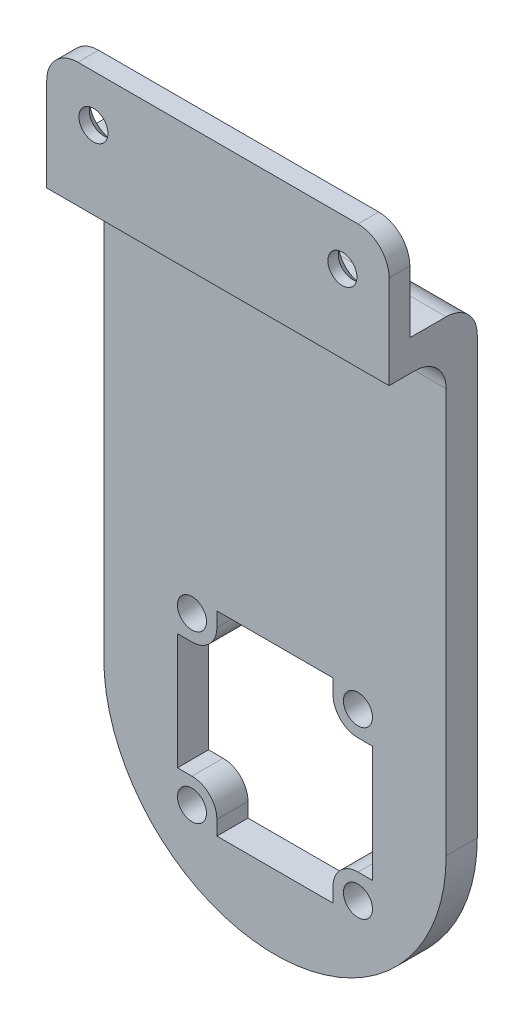
from build123d import *

# Parameters (mm, degrees)
SKETCH1_R           = 16.5
SKETCH1_R_2         = 2.4
SKETCH1_R_3         = 1.4
BOSS_EXTRUDE1_DEPTH = 3
BOSS_EXTRUDE2_START = -3
SKETCH3_R           = 1.4
BOSS_EXTRUDE2_DEPTH = 3
SKETCH4_W           = 33
SKETCH4_H           = 12
SKETCH4_R           = 1.4
BOSS_EXTRUDE3_DEPTH = 5.5
SKETCH5_W           = 33
SKETCH5_H           = 9
CUT_EXTRUDE1_DEPTH  = 6.5
FILLET1_R           = 3
CHAMFER1_SIZE       = 1


with BuildPart() as part:
    # Sketch1 → Boss-Extrude1 (new body)
    # profile 1 of 5: a face of its own
    with BuildSketch(Plane.XY):
        with Locations((3.7111495, -7.618539739)):
            Circle(SKETCH1_R)
        with BuildLine():
            ThreePointArc((-4.2888505, -2.018539739), (-5.985906775, 2.078516536), (-1.8888505, 0.381460261))
            Line((-1.8888505, 0.381460261), (-1.8888505, 1.781460261))
            Line((-1.8888505, 1.781460261), (9.3111495, 1.781460261))
            Line((9.3111495, 1.781460261), (9.3111495, 0.381460261))
            ThreePointArc((9.3111495, 0.381460261), (11.7111495, 2.781460261), (14.1111495, 0.381460261))
            ThreePointArc((14.1111495, 0.381460261), (13.408205775, -1.315596014), (11.7111495, -2.018539739))
            Line((11.7111495, -2.018539739), (13.1111495, -2.018539739))
            Line((13.1111495, -2.018539739), (13.1111495, -13.218539739))
            Line((13.1111495, -13.218539739), (11.7111495, -13.218539739))
            ThreePointArc((11.7111495, -13.218539739), (13.408205775, -13.921483464), (14.1111495, -15.618539739))
            ThreePointArc((14.1111495, -15.618539739), (11.7111495, -18.018539739), (9.3111495, -15.618539739))
            Line((9.3111495, -15.618539739), (9.3111495, -17.018539739))
            Line((9.3111495, -17.018539739), (-1.8888505, -17.018539739))
            Line((-1.8888505, -17.018539739), (-1.8888505, -15.618539739))
            ThreePointArc((-1.8888505, -15.618539739), (-5.985906775, -17.315596014), (-4.2888505, -13.218539739))
            Line((-4.2888505, -13.218539739), (-5.6888505, -13.218539739))
            Line((-5.6888505, -13.218539739), (-5.6888505, -2.018539739))
            Line((-5.6888505, -2.018539739), (-4.2888505, -2.018539739))
        make_face(mode=Mode.SUBTRACT)
    # profile 2 of 5: a face of its own
    with BuildSketch(Plane.XY):
        with Locations((11.7111495, -15.618539739)):
            Circle(SKETCH1_R_2)
        with Locations((11.7111495, -15.618539739)):
            Circle(SKETCH1_R_3, mode=Mode.SUBTRACT)
    # profile 3 of 5: a face of its own
    with BuildSketch(Plane.XY):
        with Locations((-4.2888505, -15.618539739)):
            Circle(SKETCH1_R_2)
        with Locations((-4.2888505, -15.618539739)):
            Circle(SKETCH1_R_3, mode=Mode.SUBTRACT)
    # profile 4 of 5: a face of its own
    with BuildSketch(Plane.XY):
        with Locations((-4.2888505, 0.381460261)):
            Circle(SKETCH1_R_2)
        with Locations((-4.2888505, 0.381460261)):
            Circle(SKETCH1_R_3, mode=Mode.SUBTRACT)
    # profile 5 of 5: a face of its own
    with BuildSketch(Plane.XY):
        with Locations((11.7111495, 0.381460261)):
            Circle(SKETCH1_R_2)
        with Locations((11.7111495, 0.381460261)):
            Circle(SKETCH1_R_3, mode=Mode.SUBTRACT)
    extrude(amount=BOSS_EXTRUDE1_DEPTH)

    # Sketch3 → Boss-Extrude2 (add)
    with BuildSketch(Plane.XY.offset(3).offset(BOSS_EXTRUDE2_START)):
        with BuildLine():
            Line((-12.7888505, 46.381460261), (-12.7888505, -7.618539739))
            ThreePointArc((-12.7888505, -7.618539739), (3.7111495, 8.881460261), (20.2111495, -7.618539739))
            Line((20.2111495, -7.618539739), (20.2111495, 46.381460261))
            Line((20.2111495, 46.381460261), (-12.7888505, 46.381460261))
        make_face()
        with Locations((-8.2888505, 41.881460261)):
            Circle(SKETCH3_R, mode=Mode.SUBTRACT)
        with Locations((15.7111495, 41.881460261)):
            Circle(SKETCH3_R, mode=Mode.SUBTRACT)
    extrude(amount=BOSS_EXTRUDE2_DEPTH)

    # Sketch4 → Boss-Extrude3 (add)
    with BuildSketch(Plane.XY.offset(3)):
        with Locations((3.7111495, 40.381460261)):
            Rectangle(SKETCH4_W, SKETCH4_H)
        with Locations((-8.2888505, 41.881460261)):
            Circle(SKETCH4_R, mode=Mode.SUBTRACT)
        with Locations((15.7111495, 41.881460261)):
            Circle(SKETCH4_R, mode=Mode.SUBTRACT)
    extrude(amount=BOSS_EXTRUDE3_DEPTH)

    # Sketch5 → Cut-Extrude1 (cut)
    with BuildSketch(Plane(origin=(0, 0, 0), x_dir=(-1, 0, 0), z_dir=(0, 0, -1))):
        with Locations((-3.7111495, 41.881460261)):
            Rectangle(SKETCH5_W, SKETCH5_H)
    extrude(amount=-CUT_EXTRUDE1_DEPTH, mode=Mode.SUBTRACT)

    # Fillet1
    fillet1_edges = [part.edges().sort_by_distance(p)[0] for p in [
        (20.2111495, 46.381460261, 7.5),
        (-12.7888505, 46.381460261, 7.5),
        (3.7111495, 37.381460261, 0),
        (3.7111495, 34.381460261, 3),
    ]]
    fillet(fillet1_edges, radius=FILLET1_R)

    # Chamfer1
    chamfer1_edges = [part.edges().sort_by_distance(p)[0] for p in [
        (-9.6888505, 41.881460261, 6.5),
        (14.3111495, 41.881460261, 6.5),
    ]]
    chamfer(chamfer1_edges, length=CHAMFER1_SIZE)


solid = part.part
